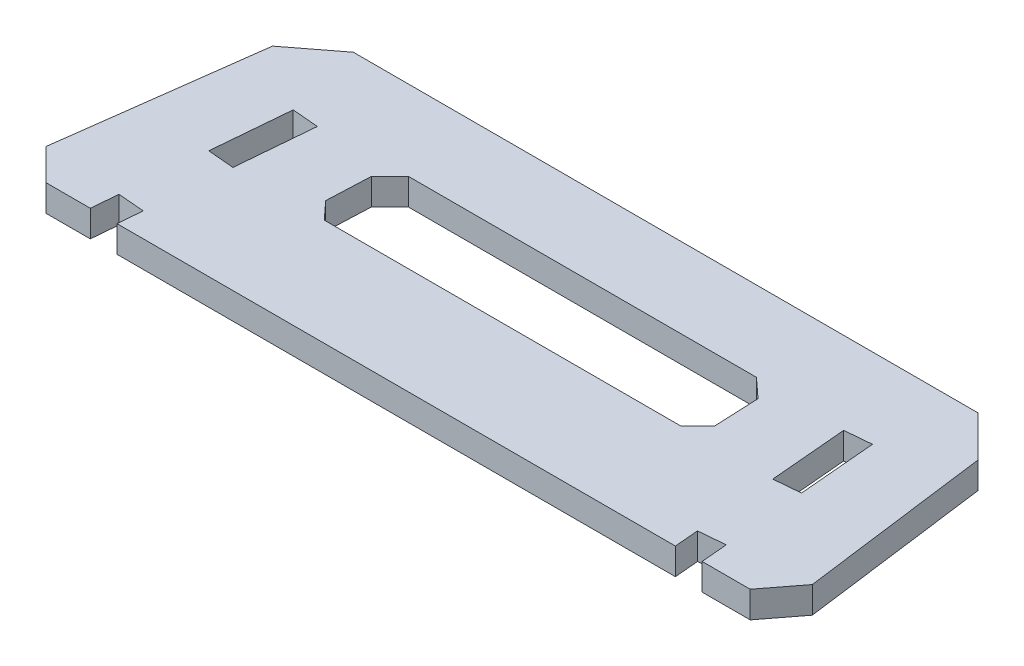
from build123d import *
from OCP.BRepFilletAPI import BRepFilletAPI_MakeChamfer

# Parameters (mm, degrees)
BOSS_EXTRUDE1_DEPTH = 15
CHAMFER1_SIZE       = 10
CHAMFER1_SIZE2      = 10.462732323
CHAMFER1_SIZE2_2    = 9.593689253
CHAMFER2_SIZE       = 20
CHAMFER2_SIZE2      = 23.221000733
CHAMFER2_SIZE2_2    = 17.830293244


with BuildPart() as part:
    # Sketch2 → Boss-Extrude1 (new body)
    with BuildSketch(Plane(origin=(0, 0, 0), x_dir=(1, 0, 0), z_dir=(0, 1, 0))):
        Polygon((197.980321351, 0), (217.75302006, -150.572975632), (172.735338859, -150.572975632), (171.432941589, -135.629642818), (156.489589987, -136.932041726), (157.678475714, -150.572975632), (-157.678475714, -150.572975632), (-156.489589987, -136.932041726), (-171.432941589, -135.629642818), (-172.735338859, -150.572975632), (-217.75302006, -150.572975632), (-197.980321351, 0), align=None)
        Polygon((108.492166043, -45.171892689), (110.449460378, -90.343785379), (-110.449460378, -90.343785379), (-108.492166043, -45.171892689), align=None, mode=Mode.SUBTRACT)
        Polygon((-163.549029189, -45.171892689), (-167.372507504, -89.041386471), (-152.429155902, -90.343785379), (-148.605677588, -46.474291597), align=None, mode=Mode.SUBTRACT)
        Polygon((152.429155902, -90.343785379), (148.605677588, -46.474291597), (163.549029189, -45.171892689), (167.372507504, -89.041386471), align=None, mode=Mode.SUBTRACT)
    extrude(amount=-BOSS_EXTRUDE1_DEPTH)

    # Chamfer1: one chamfer whose edges measure the first distance from different faces: ONE call of the kernel's chamfer builder (chamfer() names one face for all edges)
    chamfer1_edges_1 = [part.edges().sort_by_distance(p)[0] for p in [
        (-108.492166043, -7.5, 45.171892689),
    ]]
    chamfer1_side_1 = [part.faces().sort_by_distance(p)[0] for p in [
        (0, -7.5, 45.171892689),
    ]]
    chamfer1_edges_2 = [part.edges().sort_by_distance(p)[0] for p in [
        (108.492166043, -7.5, 45.171892689),
    ]]
    chamfer1_side_2 = [part.faces().sort_by_distance(p)[0] for p in [
        (109.470813211, -7.5, 67.757839034),
    ]]
    chamfer1_edges_3 = [part.edges().sort_by_distance(p)[0] for p in [
        (110.449460378, -7.5, 90.343785379),
    ]]
    chamfer1_side_3 = [part.faces().sort_by_distance(p)[0] for p in [
        (0, -7.5, 90.343785379),
    ]]
    chamfer1_edges_4 = [part.edges().sort_by_distance(p)[0] for p in [
        (-110.449460378, -7.5, 90.343785379),
    ]]
    chamfer1_side_4 = [part.faces().sort_by_distance(p)[0] for p in [
        (-109.470813211, -7.5, 67.757839034),
    ]]
    chamfer1 = BRepFilletAPI_MakeChamfer(part.part.solid().wrapped)
    for e in chamfer1_edges_1:
        chamfer1.Add(CHAMFER1_SIZE, CHAMFER1_SIZE2, e.wrapped, chamfer1_side_1[0].wrapped)  # the first distance lies on this face
    for e in chamfer1_edges_2:
        chamfer1.Add(CHAMFER1_SIZE, CHAMFER1_SIZE2, e.wrapped, chamfer1_side_2[0].wrapped)  # the first distance lies on this face
    for e in chamfer1_edges_3:
        chamfer1.Add(CHAMFER1_SIZE, CHAMFER1_SIZE2_2, e.wrapped, chamfer1_side_3[0].wrapped)  # the first distance lies on this face
    for e in chamfer1_edges_4:
        chamfer1.Add(CHAMFER1_SIZE, CHAMFER1_SIZE2_2, e.wrapped, chamfer1_side_4[0].wrapped)  # the first distance lies on this face
    add(Compound.cast(chamfer1.Shape()), mode=Mode.REPLACE)

    # Chamfer2: one chamfer whose edges measure the first distance from different faces: ONE call of the kernel's chamfer builder (chamfer() names one face for all edges)
    chamfer2_edges_1 = [part.edges().sort_by_distance(p)[0] for p in [
        (197.980321351, -7.5, 0),
    ]]
    chamfer2_side_1 = [part.faces().sort_by_distance(p)[0] for p in [
        (0, -7.5, 0),
    ]]
    chamfer2_edges_2 = [part.edges().sort_by_distance(p)[0] for p in [
        (217.75302006, -7.5, 150.572975632),
    ]]
    chamfer2_side_2 = [part.faces().sort_by_distance(p)[0] for p in [
        (207.866670706, -7.5, 75.286487816),
    ]]
    chamfer2_edges_3 = [part.edges().sort_by_distance(p)[0] for p in [
        (-217.75302006, -7.5, 150.572975632),
    ]]
    chamfer2_side_3 = [part.faces().sort_by_distance(p)[0] for p in [
        (-195.24417946, -7.5, 150.572975632),
    ]]
    chamfer2_edges_4 = [part.edges().sort_by_distance(p)[0] for p in [
        (-197.980321351, -7.5, 0),
    ]]
    chamfer2_side_4 = [part.faces().sort_by_distance(p)[0] for p in [
        (-207.866670706, -7.5, 75.286487816),
    ]]
    chamfer2 = BRepFilletAPI_MakeChamfer(part.part.solid().wrapped)
    for e in chamfer2_edges_1:
        chamfer2.Add(CHAMFER2_SIZE, CHAMFER2_SIZE2, e.wrapped, chamfer2_side_1[0].wrapped)  # the first distance lies on this face
    for e in chamfer2_edges_2:
        chamfer2.Add(CHAMFER2_SIZE, CHAMFER2_SIZE2_2, e.wrapped, chamfer2_side_2[0].wrapped)  # the first distance lies on this face
    for e in chamfer2_edges_3:
        chamfer2.Add(CHAMFER2_SIZE, CHAMFER2_SIZE2_2, e.wrapped, chamfer2_side_3[0].wrapped)  # the first distance lies on this face
    for e in chamfer2_edges_4:
        chamfer2.Add(CHAMFER2_SIZE, CHAMFER2_SIZE2, e.wrapped, chamfer2_side_4[0].wrapped)  # the first distance lies on this face
    add(Compound.cast(chamfer2.Shape()), mode=Mode.REPLACE)


solid = part.part
